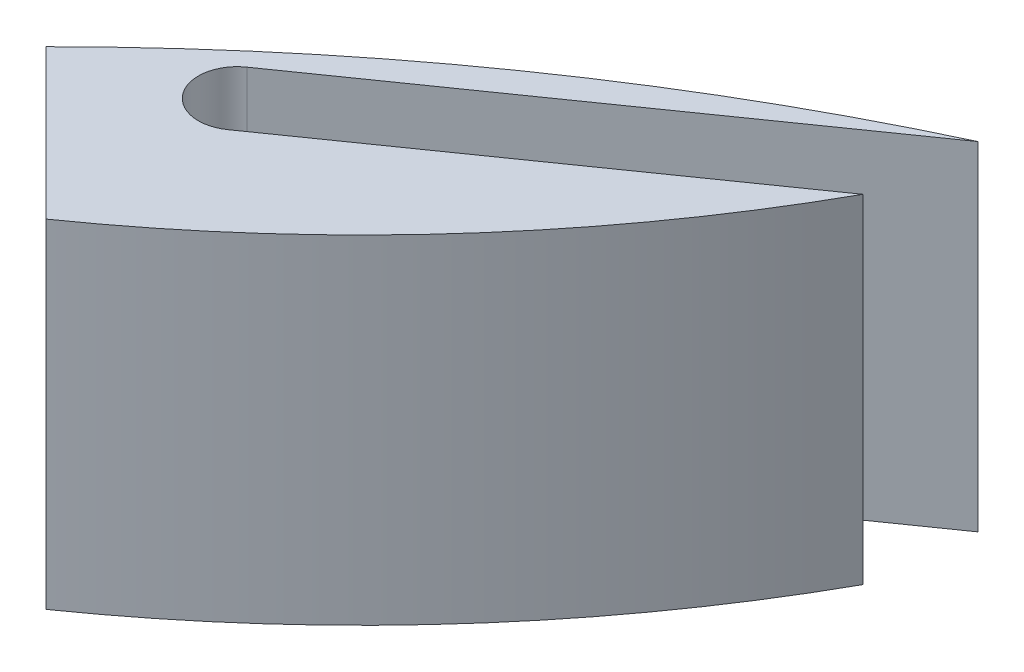
from build123d import *

# Parameters (mm, degrees)
BOSS_EXTRUDE1_DEPTH = 5


with BuildPart() as part:
    # Sketch2 → Boss-Extrude1 (new, symmetric)
    with BuildSketch(Plane(origin=(0, 0, 0), x_dir=(1, 0, 0), z_dir=(0, 1, 0))):
        with BuildLine():
            Line((-40.305086528, 40.305086528), (-35.889294013, 35.889294013))
            ThreePointArc((-35.889294013, 35.889294013), (-29.44113155, 41.594605349), (-24.442210759, 48.604610165))
            Line((-24.442210759, 48.604610165), (-35.492601187, 40.867043487))
            ThreePointArc((-35.492601187, 40.867043487), (-37.094238939, 41.149455436), (-36.81182699, 42.751093189))
            Line((-36.81182699, 42.751093189), (-24.089240919, 51.659543861))
            ThreePointArc((-24.089240919, 51.659543861), (-32.693856872, 46.691666524), (-40.305086528, 40.305086528))
        make_face()
    extrude(amount=BOSS_EXTRUDE1_DEPTH, both=True)


solid = part.part
